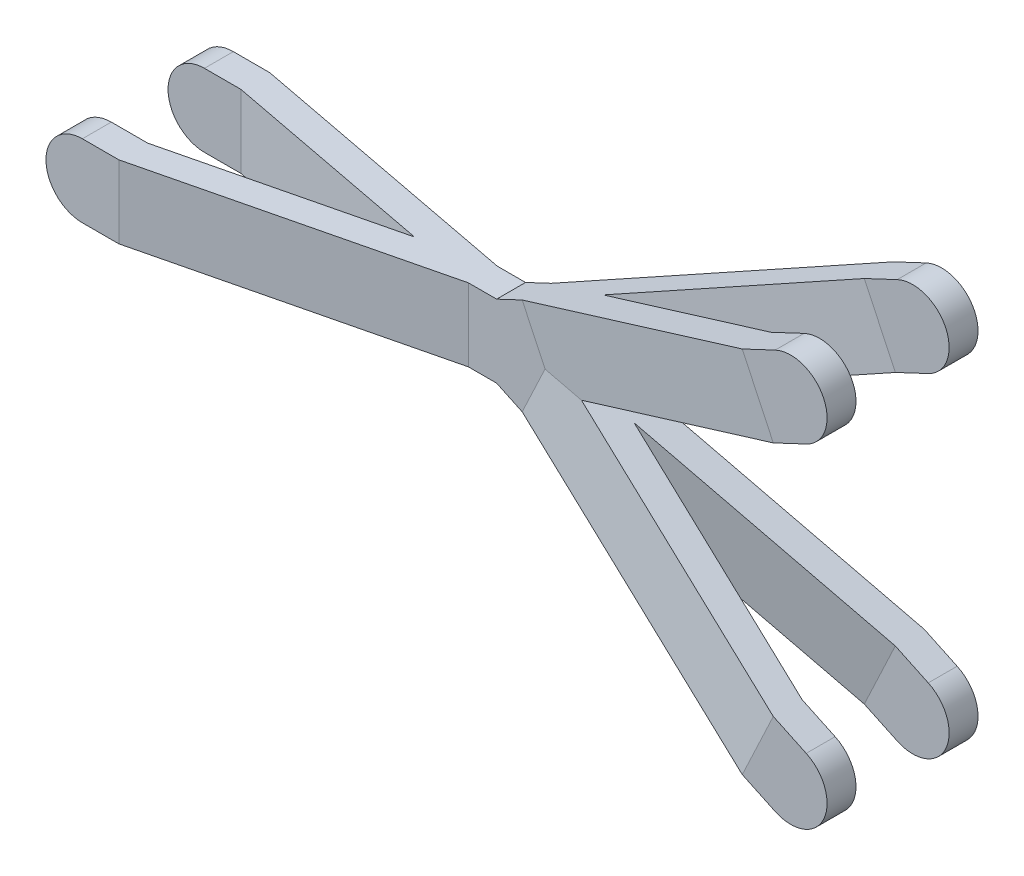
from build123d import *

# Parameters (mm, degrees)
SKETCH2_R             = 4
BOSS_EXTRUDE1_DEPTH   = 1.5875
BOSS_EXTRUDE1_2_DEPTH = 1.5875
BOSS_EXTRUDE1_3_DEPTH = 1.5875
BOSS_EXTRUDE2_START   = 15
SKETCH2_3_R           = 4
BOSS_EXTRUDE2_DEPTH   = 3.175
BOSS_EXTRUDE2_2_DEPTH = 3.175
BOSS_EXTRUDE2_3_DEPTH = 3.175
BOSS_EXTRUDE3_START   = 7.5
SKETCH2_5_R           = 4
BOSS_EXTRUDE3_DEPTH   = 3.175
BOSS_EXTRUDE5_DEPTH   = 4
BOSS_EXTRUDE6_DEPTH   = 4
BOSS_EXTRUDE8_DEPTH   = 4


with BuildPart() as part:
    # Sketch2 → Boss-Extrude1 (new, symmetric)
    with BuildSketch(Plane.XY):
        with Locations((94.5382, -57.8618)):
            Circle(SKETCH2_R)
    extrude(amount=BOSS_EXTRUDE1_DEPTH, both=True)



with BuildPart() as body_2:
    # Sketch2 → Boss-Extrude1 2 (new, symmetric)
    with BuildSketch(Plane.XY):
        with Locations((16.7, -76.2)):
            Circle(SKETCH2_R)
    extrude(amount=BOSS_EXTRUDE1_2_DEPTH, both=True)



with BuildPart() as body_3:
    # Sketch2 → Boss-Extrude1 3 (new, symmetric)
    with BuildSketch(Plane.XY):
        with Locations((94.5382, -94.5382)):
            Circle(SKETCH2_R)
    extrude(amount=BOSS_EXTRUDE1_3_DEPTH, both=True)


with BuildPart() as body_4:
    # Sketch2<3> → Boss-Extrude2 (new body)
    with BuildSketch(Plane.XY.offset(BOSS_EXTRUDE2_START)):
        with Locations((94.5382, -57.8618)):
            Circle(SKETCH2_3_R)
    extrude(amount=-BOSS_EXTRUDE2_DEPTH)


with BuildPart() as body_5:
    # Sketch2<3> → Boss-Extrude2 2 (new body)
    with BuildSketch(Plane.XY.offset(BOSS_EXTRUDE2_START)):
        with Locations((16.7, -76.2)):
            Circle(SKETCH2_3_R)
    extrude(amount=-BOSS_EXTRUDE2_2_DEPTH)


with BuildPart() as body_6:
    # Sketch2<3> → Boss-Extrude2 3 (new body)
    with BuildSketch(Plane.XY.offset(BOSS_EXTRUDE2_START)):
        with Locations((94.5382, -94.5382)):
            Circle(SKETCH2_3_R)
    extrude(amount=-BOSS_EXTRUDE2_3_DEPTH)


with BuildPart() as body_7:
    # Sketch2<5> → Boss-Extrude3 (new body)
    with BuildSketch(Plane.XY.offset(BOSS_EXTRUDE3_START)):
        with Locations((55.6191, -76.2)):
            Circle(SKETCH2_5_R)
    extrude(amount=-BOSS_EXTRUDE3_DEPTH)


with BuildPart() as body_2_1:
    add(body_2.part)

    add(body_5.part)  # Boss-Extrude5 merges body 5

    add(body_7.part)  # Boss-Extrude5 merges body 7
    # Sketch3 → Boss-Extrude5 (add, symmetric)
    with BuildSketch(Plane(origin=(0, -76.2, 0), x_dir=(1, 0, 0), z_dir=(0, 1, 0))):
        Polygon((51.6191, -4.325), (20.7, 1.5875), (16.7, 1.5875), (16.7, -1.5875), (20.7, -1.5875), (44.299946785, -6.100396086), (20.7, -11.825), (16.7, -11.825), (16.7, -15), (20.7, -15), (51.6191, -7.5), (55.6191, -7.5), (55.6191, -4.325), align=None)
    extrude(amount=BOSS_EXTRUDE5_DEPTH, both=True)


    add(body_3.part)  # Boss-Extrude6 merges body 3

    add(body_6.part)  # Boss-Extrude6 merges body 6
    # Sketch5 → Boss-Extrude6 (add, symmetric)
    with BuildSketch(Plane(origin=(-19.276371181, -40.910177532, 0), x_dir=(-0.9046096798275906, 0.4262409261934197, 0), z_dir=(-0.42624092619341963, -0.9046096798275904, 0))):
        Polygon((-86.793134819, -4.325), (-121.816220762, 1.5875), (-125.816220762, 1.5875), (-125.816220762, -1.5875), (-121.816220762, -1.5875), (-95.083781445, -6.100396086), (-121.816220762, -11.825), (-125.816220762, -11.825), (-125.816220762, -15), (-121.816220762, -15), (-86.793134819, -7.5), (-82.793134819, -7.5), (-82.793134819, -4.325), align=None)
    extrude(amount=BOSS_EXTRUDE6_DEPTH, both=True)


with BuildPart() as part_1:
    add(part.part)

    add(body_2_1.part)  # Boss-Extrude8 merges body 2

    add(body_4.part)  # Boss-Extrude8 merges body 4
    # Sketch7 → Boss-Extrude8 (add, symmetric)
    with BuildSketch(Plane(origin=(39.486274988, -83.801588208, 0), x_dir=(0.9046096798275907, 0.4262409261934195, 0), z_dir=(-0.4262409261934195, 0.9046096798275907, 0))):
        Polygon((30.124664293, -6.100396086), (56.85710361, -1.5875), (60.85710361, -1.5875), (60.85710361, 1.5875), (56.85710361, 1.5875), (21.834017667, -4.325), (17.834017667, -4.325), (17.834017667, -7.5), (21.834017667, -7.5), (56.85710361, -15), (60.85710361, -15), (60.85710361, -11.825), (56.85710361, -11.825), align=None)
    extrude(amount=BOSS_EXTRUDE8_DEPTH, both=True)


solid = part_1.part
